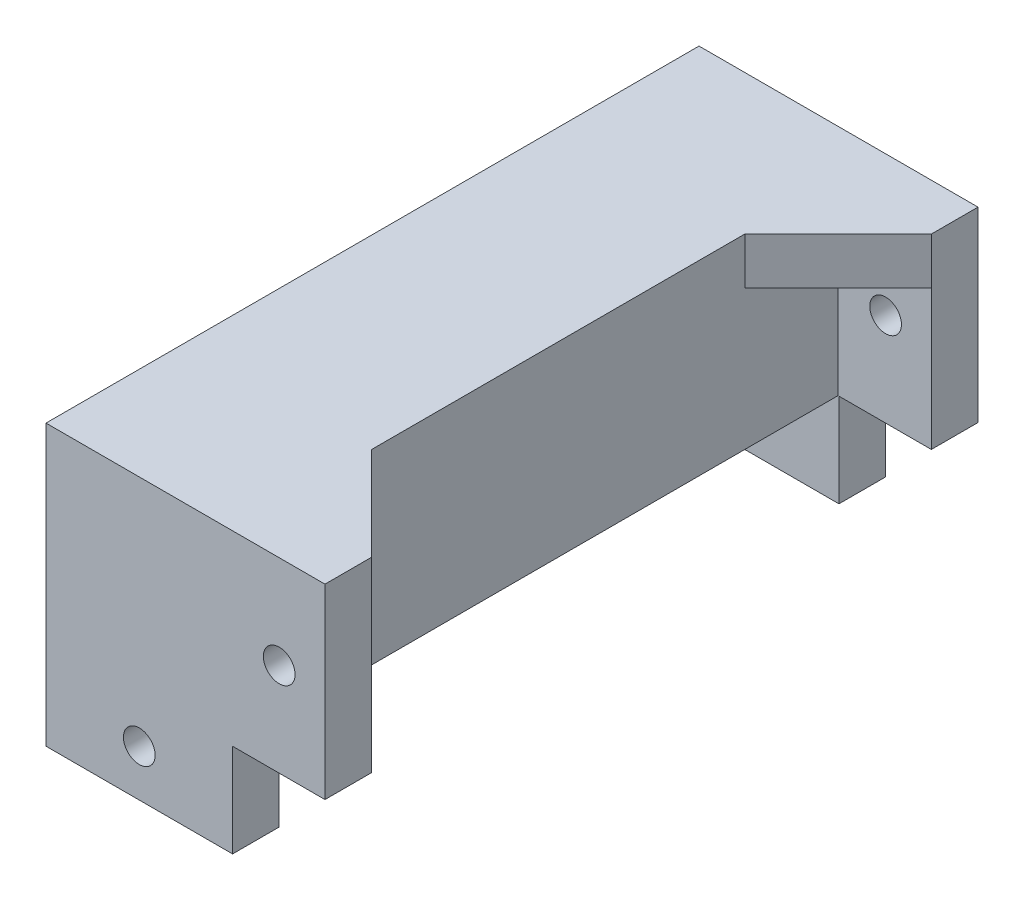
from build123d import *

# Parameters (mm, degrees)
SKETCH1_R           = 1.7
BOSS_EXTRUDE1_DEPTH = 70
SKETCH2_W           = 60
SKETCH2_H           = 10
CUT_EXTRUDE1_DEPTH  = 25
BOSS_EXTRUDE2_DEPTH = 5
SKETCH4_W           = 10
SKETCH4_H           = 60
CUT_EXTRUDE2_DEPTH  = 20
BOSS_EXTRUDE3_DEPTH = 5


with BuildPart() as part:
    # Sketch1 → Boss-Extrude1 (new body)
    with BuildSketch(Plane.XY.offset(246.476360497)):
        Polygon((-42.55341426, 305.4352577), (-42.55341426, 275.4352577), (-22.55341426, 275.4352577), (-22.55341426, 285.4352577), (-12.649269186, 285.4352577), (-12.649269186, 305.4352577), align=None)
        with Locations((-17.55341426, 295.4352577)):
            Circle(SKETCH1_R, mode=Mode.SUBTRACT)
        with Locations((-32.55341426, 280.4352577)):
            Circle(SKETCH1_R, mode=Mode.SUBTRACT)
    extrude(amount=BOSS_EXTRUDE1_DEPTH)

    # Sketch2 → Cut-Extrude1 (cut)
    with BuildSketch(Plane.ZY.offset(42.55341426)):
        with Locations((281.476360497, 280.4352577)):
            Rectangle(SKETCH2_W, SKETCH2_H)
    extrude(amount=-CUT_EXTRUDE1_DEPTH, mode=Mode.SUBTRACT)

    # Sketch3 → Boss-Extrude2 (add)
    with BuildSketch(Plane.ZY.offset(42.55341426)):
        Polygon((311.476360497, 275.4352577), (301.476360497, 285.4352577), (261.476360497, 285.4352577), (251.476360497, 275.4352577), (246.476360497, 275.4352577), (246.476360497, 305.4352577), (316.476360497, 305.4352577), (316.476360497, 275.4352577), align=None)
    extrude(amount=-BOSS_EXTRUDE2_DEPTH)

    # Sketch4 → Cut-Extrude2 (cut)
    with BuildSketch(Plane(origin=(0, 305.4352577, 0), x_dir=(1, 0, 0), z_dir=(0, 1, 0))):
        with Locations((-17.649269186, -281.476360497)):
            Rectangle(SKETCH4_W, SKETCH4_H)
    extrude(amount=-CUT_EXTRUDE2_DEPTH, mode=Mode.SUBTRACT)

    # Sketch5 → Boss-Extrude3 (add)
    with BuildSketch(Plane(origin=(0, 305.4352577, 0), x_dir=(1, 0, 0), z_dir=(0, 1, 0))):
        Polygon((-12.649269186, -311.476360497), (-22.649269186, -301.476360497), (-22.649269186, -261.476360497), (-12.649269186, -251.476360497), (-12.649269186, -246.476360497), (-42.55341426, -246.476360497), (-42.55341426, -316.476360497), (-12.649269186, -316.476360497), align=None)
    extrude(amount=-BOSS_EXTRUDE3_DEPTH)


solid = part.part
